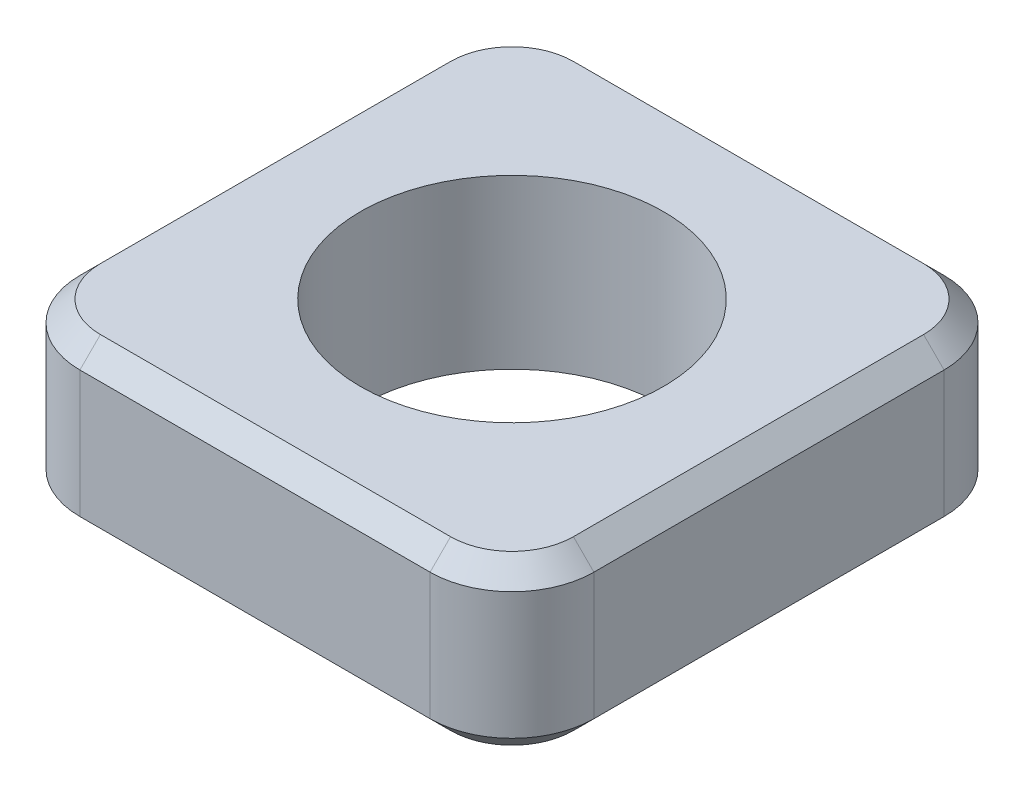
from build123d import *

# Parameters (mm, degrees)
SKETCH1_R           = 1.85
BOSS_EXTRUDE1_DEPTH = 2.05
CHAMFER1_SIZE       = 0.25


with BuildPart() as part:
    # Sketch1 → Boss-Extrude1 (new body)
    with BuildSketch(Plane(origin=(0, 0, 0), x_dir=(1, 0, 0), z_dir=(0, 1, 0))):
        with BuildLine():
            Line((-2.1375, 3.1375), (2.1375, 3.1375))
            ThreePointArc((2.1375, 3.1375), (2.844606781, 2.844606781), (3.1375, 2.1375))
            Line((3.1375, 2.1375), (3.1375, -2.1375))
            ThreePointArc((3.1375, -2.1375), (2.844606781, -2.844606781), (2.1375, -3.1375))
            Line((2.1375, -3.1375), (-2.1375, -3.1375))
            ThreePointArc((-2.1375, -3.1375), (-2.844606781, -2.844606781), (-3.1375, -2.1375))
            Line((-3.1375, -2.1375), (-3.1375, 2.1375))
            ThreePointArc((-3.1375, 2.1375), (-2.844606781, 2.844606781), (-2.1375, 3.1375))
        make_face()
        with Locations(Location((0, 0, 0), (0, 0, 270))):
            Circle(SKETCH1_R, mode=Mode.SUBTRACT)
    extrude(amount=BOSS_EXTRUDE1_DEPTH)

    # Chamfer1
    chamfer1_edges = [part.edges().sort_by_distance(p)[0] for p in [
        (2.844606781, 2.05, -2.844606781),
        (3.1375, 0, 0),
        (2.844606781, 0, 2.844606781),
        (0, 2.05, -3.1375),
        (-2.844606781, 2.05, -2.844606781),
        (-3.1375, 2.05, 0),
        (-2.844606781, 2.05, 2.844606781),
        (0, 2.05, 3.1375),
        (2.844606781, 2.05, 2.844606781),
        (3.1375, 2.05, 0),
        (0, 0, 3.1375),
        (-2.844606781, 0, 2.844606781),
        (-3.1375, 0, 0),
        (-2.844606781, 0, -2.844606781),
        (0, 0, -3.1375),
        (2.844606781, 0, -2.844606781),
    ]]
    chamfer(chamfer1_edges, length=CHAMFER1_SIZE)


solid = part.part
